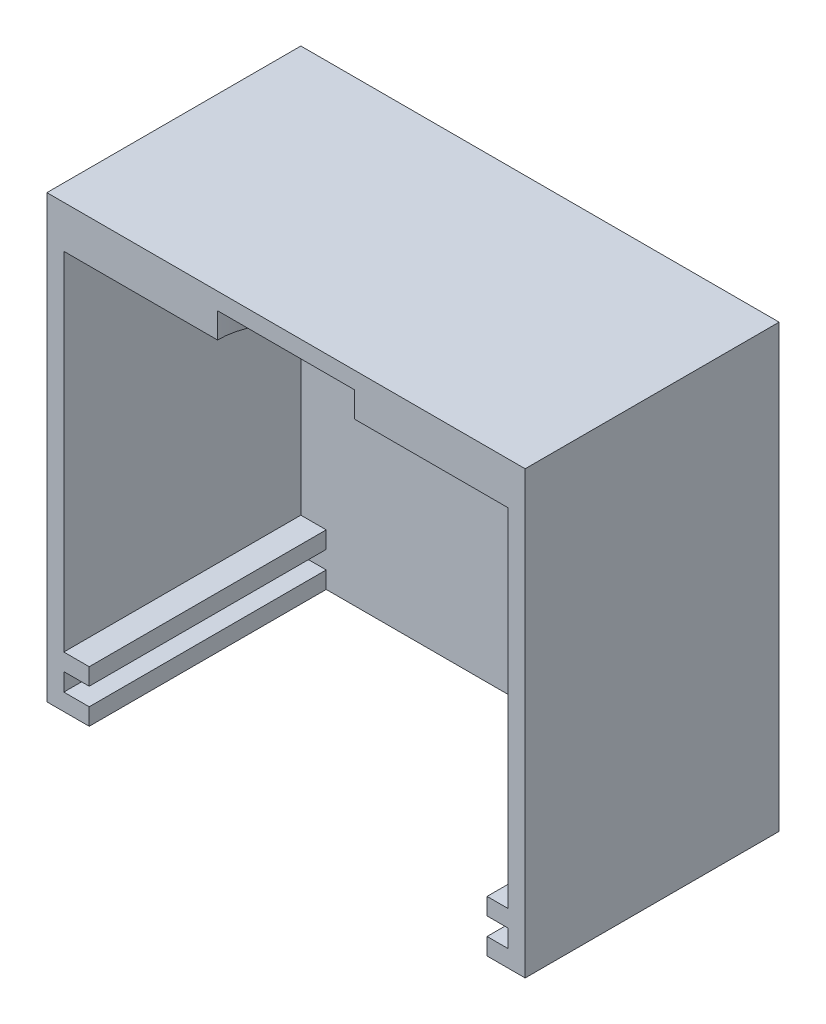
from build123d import *

# Parameters (mm, degrees)
SKETCH1_W           = 56.5
SKETCH1_H           = 60
BOSS_EXTRUDE1_DEPTH = 30
SHELL1_T            = -2
SKETCH2_W           = 52.5
SKETCH2_H           = 3
BOSS_EXTRUDE2_DEPTH = 28
CUT_EXTRUDE5_DEPTH  = 3
SKETCH6_W           = 30
SKETCH6_H           = 2
BOSS_EXTRUDE3_DEPTH = 3
SKETCH7_W           = 30
SKETCH7_H           = 2
BOSS_EXTRUDE4_DEPTH = 3
SKETCH8_W           = 56.5
SKETCH8_H           = 30
CUT_EXTRUDE6_DEPTH  = 7.9


with BuildPart() as part:
    # Sketch1 → Boss-Extrude1 (new body)
    with BuildSketch(Plane.XY):
        with Locations((-28.25, 30)):
            Rectangle(SKETCH1_W, SKETCH1_H)
    extrude(amount=BOSS_EXTRUDE1_DEPTH)

    # Shell1
    shell1_openings = [part.faces().sort_by_distance(p)[0] for p in [
        (-28.25, 30, 30),
    ]]
    offset(amount=SHELL1_T, openings=shell1_openings, kind=Kind.INTERSECTION)

    # Sketch2 → Boss-Extrude2 (add)
    with BuildSketch(Plane.XY.offset(2)):
        with Locations((-28.25, 56.5)):
            Rectangle(SKETCH2_W, SKETCH2_H)
    extrude(amount=BOSS_EXTRUDE2_DEPTH)

    # Sketch3 → Cut-Extrude5 (cut)
    with BuildSketch(Plane.XZ.offset(-55)):
        with BuildLine():
            Line((-36.35, 30), (-20.15, 30))
            ThreePointArc((-20.15, 30), (-28.25, 21.9), (-36.35, 30))
        make_face()
    extrude(amount=-CUT_EXTRUDE5_DEPTH, mode=Mode.SUBTRACT)

    # Sketch6 → Boss-Extrude3 (add)
    with BuildSketch(Plane(origin=(-54.5, 0, 0), x_dir=(0, 0, -1), z_dir=(1, 0, 0))):
        with Locations((-15, 13)):
            Rectangle(SKETCH6_W, SKETCH6_H)
    boss_extrude3 = extrude(amount=BOSS_EXTRUDE3_DEPTH)

    # Sketch7 → Boss-Extrude4 (add)
    with BuildSketch(Plane(origin=(-54.5, 0, 0), x_dir=(0, 0, -1), z_dir=(1, 0, 0))):
        with Locations((-15, 8.9)):
            Rectangle(SKETCH7_W, SKETCH7_H)
    boss_extrude4 = extrude(amount=BOSS_EXTRUDE4_DEPTH)

    # Mirror1: Boss-Extrude3, Boss-Extrude4 across plane
    add(boss_extrude3.mirror(Plane(origin=(-28, 0, 0), x_dir=(0, 0, 1), z_dir=(1, 0, 0))))
    add(boss_extrude4.mirror(Plane(origin=(-28, 0, 0), x_dir=(0, 0, 1), z_dir=(1, 0, 0))))

    # Sketch8 → Cut-Extrude6 (cut)
    with BuildSketch(Plane.XZ):
        with Locations((-28.25, 15)):
            Rectangle(SKETCH8_W, SKETCH8_H)
    extrude(amount=-CUT_EXTRUDE6_DEPTH, mode=Mode.SUBTRACT)


solid = part.part
